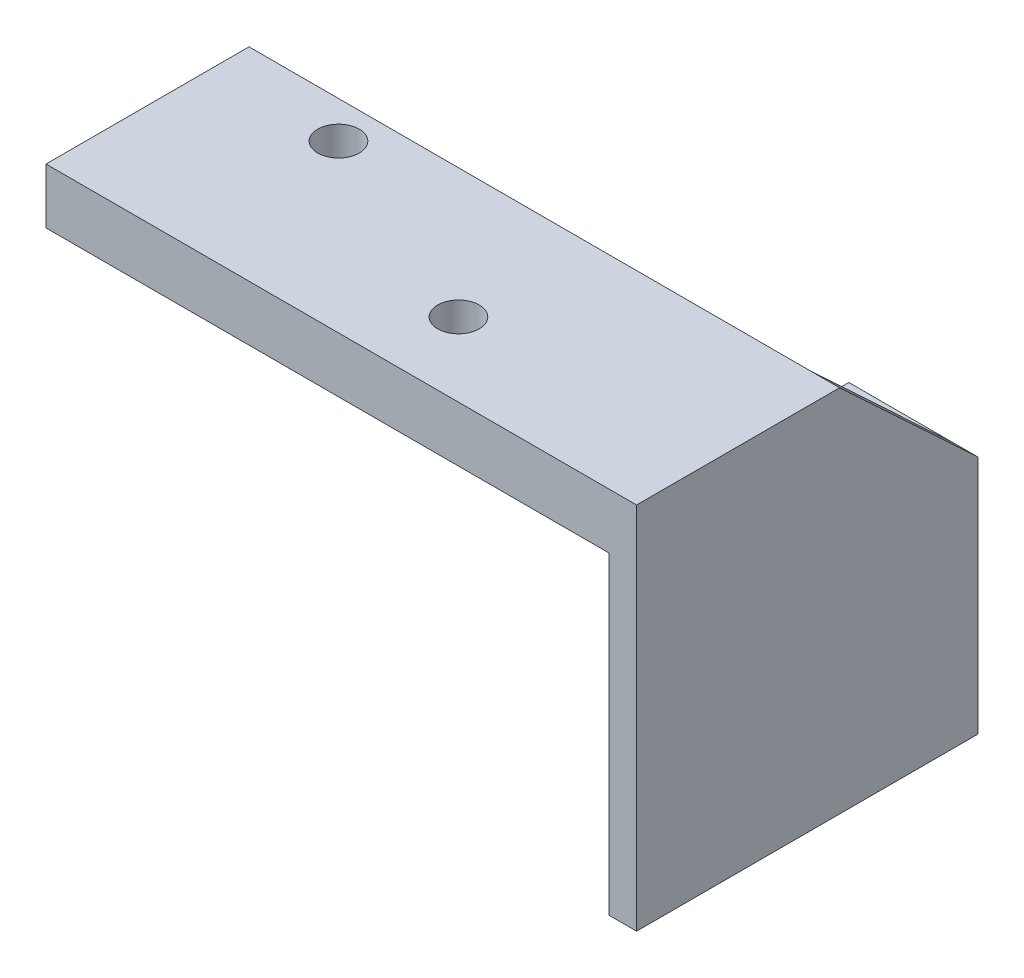
from build123d import *

# Parameters (mm, degrees)
ESQUISSE1_W                                        = 11
ESQUISSE1_H                                        = 26
BOSS_EXTRU_1_DEPTH                                 = 9
CHAMBRAGE_POUR_VIS_T_TE_RONDE_BOMB_E_M_D           = 3.4
CHAMBRAGE_POUR_VIS_T_TE_RONDE_BOMB_E_M_CBORE_D     = 7
CHAMBRAGE_POUR_VIS_T_TE_RONDE_BOMB_E_M_CBORE_DEPTH = 2.4
BOSS_EXTRU_2_DEPTH                                 = 40
DIAM_TRE_DU_PER_AGE_4_5_4_5_1_D                    = 4.5
ESQUISSE20_W                                       = 11
ESQUISSE20_H                                       = 28
ENL_V_MAT_EXTRU_6_DEPTH                            = 78.776924598
ESQUISSE21_W                                       = 50
ESQUISSE21_H                                       = 34
ENL_V_MAT_EXTRU_7_DEPTH                            = 72.960058366
ESQUISSE23_W                                       = 11
ESQUISSE23_H                                       = 14
BOSS_EXTRU_3_DEPTH                                 = 37
ESQUISSE24_W                                       = 37
ESQUISSE24_H                                       = 40
BOSS_EXTRU_4_DEPTH                                 = 3
ESQUISSE27_W                                       = 11
ESQUISSE27_H                                       = 37
ENL_V_MAT_EXTRU_11_DEPTH                           = 8
ESQUISSE28_W                                       = 64
ESQUISSE28_H                                       = 15
ENL_V_MAT_EXTRU_12_DEPTH                           = 6
ESQUISSE30_W                                       = 15
ESQUISSE30_H                                       = 8
ENL_V_MAT_EXTRU_13_DEPTH                           = 77.282370178
BOSS_EXTRU_6_DEPTH                                 = 3


with BuildPart() as part:
    # Esquisse1 → Boss.-Extru.1 (new body)
    with BuildSketch(Plane.XY):
        Rectangle(ESQUISSE1_W, ESQUISSE1_H)
    extrude(amount=BOSS_EXTRU_1_DEPTH)

    # Chambrage pour vis à tête ronde bombée M31 (through all)
    with Locations(Plane.XY.offset(9)):
        with Locations((0, 7.5), (0, -7.5)):
            CounterBoreHole(CHAMBRAGE_POUR_VIS_T_TE_RONDE_BOMB_E_M_D / 2, CHAMBRAGE_POUR_VIS_T_TE_RONDE_BOMB_E_M_CBORE_D / 2, CHAMBRAGE_POUR_VIS_T_TE_RONDE_BOMB_E_M_CBORE_DEPTH)

    # Esquisse8 → Boss.-Extru.2 (add)
    with BuildSketch(Plane.XZ.offset(13)):
        Polygon((-55.5, 0), (-55.5, 37), (5.5, 37), (5.5, 9), (-5.5, 9), (-5.5, 0), align=None)
    extrude(amount=-BOSS_EXTRU_2_DEPTH)

    # Diamètre du perçage Ø4.5 (4.5)1 (through all)
    with Locations(Plane(origin=(0, 27, 0), x_dir=(1, 0, 0), z_dir=(0, 1, 0))):
        with Locations((-41.801370091, -19.00055804), (-18.801370091, -29.00055804)):
            Hole(DIAM_TRE_DU_PER_AGE_4_5_4_5_1_D / 2)

    # Esquisse20 → Enlèv. mat.-Extru.6 (cut, through all)
    with BuildSketch(Plane(origin=(0, 27, 0), x_dir=(1, 0, 0), z_dir=(0, 1, 0))):
        with Locations((0, -23)):
            Rectangle(ESQUISSE20_W, ESQUISSE20_H)
    extrude(amount=-ENL_V_MAT_EXTRU_6_DEPTH, mode=Mode.SUBTRACT)

    # Esquisse21 → Enlèv. mat.-Extru.7 (cut, through all)
    with BuildSketch(Plane.XY.offset(37)):
        with Locations((-30.5, 4)):
            Rectangle(ESQUISSE21_W, ESQUISSE21_H)
    extrude(amount=-ENL_V_MAT_EXTRU_7_DEPTH, mode=Mode.SUBTRACT)


with BuildPart() as enl_v_mat_extru_7_piece_1:
    # of the separate pieces the step leaves, piece 1, a body of its own (enl_v_mat_extru_7_pieces)
    add(part.part.solids().sort_by_distance((-5.5, 21, 0))[0])



with BuildPart() as enl_v_mat_extru_7_piece_2:
    # of the separate pieces the step leaves, piece 2, a body of its own (enl_v_mat_extru_7_pieces)
    add(part.part.solids().sort_by_distance((5.5, 13, 0))[0])


with BuildPart() as enl_v_mat_extru_7_piece_1_1:
    add(enl_v_mat_extru_7_piece_1.part)

    add(enl_v_mat_extru_7_piece_2.part)  # Boss.-Extru.3 merges Enlèv. mat.-Extru.7 piece 2
    # Esquisse23 → Boss.-Extru.3 (add, through all)
    with BuildSketch(Plane.XY.offset(37)):
        with Locations((0, 20)):
            Rectangle(ESQUISSE23_W, ESQUISSE23_H)
    extrude(amount=-BOSS_EXTRU_3_DEPTH)

    # Esquisse24 → Boss.-Extru.4 (add)
    with BuildSketch(Plane(origin=(5.5, 0, 0), x_dir=(0, 0, -1), z_dir=(1, 0, 0))):
        with Locations((-18.5, 7)):
            Rectangle(ESQUISSE24_W, ESQUISSE24_H)
    extrude(amount=BOSS_EXTRU_4_DEPTH)

    # Esquisse27 → Enlèv. mat.-Extru.11 (cut)
    with BuildSketch(Plane.XZ.offset(-21)):
        with Locations((0, 18.5)):
            Rectangle(ESQUISSE27_W, ESQUISSE27_H)
    extrude(amount=ENL_V_MAT_EXTRU_11_DEPTH, mode=Mode.SUBTRACT)

    # Esquisse28 → Enlèv. mat.-Extru.12 (cut)
    with BuildSketch(Plane(origin=(0, 27, 0), x_dir=(1, 0, 0), z_dir=(0, 1, 0))):
        with Locations((-23.5, -7.5)):
            Rectangle(ESQUISSE28_W, ESQUISSE28_H)
    extrude(amount=-ENL_V_MAT_EXTRU_12_DEPTH, mode=Mode.SUBTRACT)

    # Esquisse30 → Enlèv. mat.-Extru.13 (cut, through all)
    with BuildSketch(Plane.ZY.offset(-5.5)):
        with Locations((7.5, 17)):
            Rectangle(ESQUISSE30_W, ESQUISSE30_H)
    extrude(amount=-ENL_V_MAT_EXTRU_13_DEPTH, mode=Mode.SUBTRACT)

    # Esquisse31 → Boss.-Extru.6 (add, through all)
    with BuildSketch(Plane.ZY.offset(-5.5)):
        Polygon((15, 27), (0, 13), (15, 13), align=None)
    extrude(amount=-BOSS_EXTRU_6_DEPTH)


solid = enl_v_mat_extru_7_piece_1_1.part
